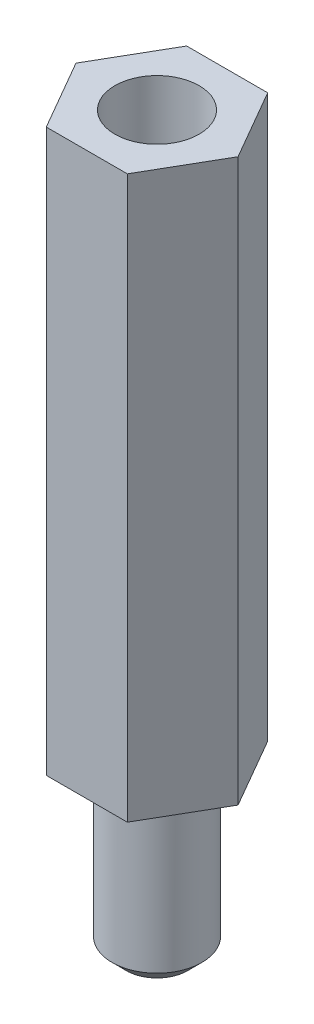
from build123d import *

# Parameters (mm, degrees)
SKETCH1_R           = 1.5
EXTRUDE1_DEPTH      = 20
EXTRUDE2_DEPTH      = 6
EXTRUDE2_DEPTH_BACK = 12
SKETCH2_R           = 1.6
CHAMFER1_SIZE       = 0.5
FILLET1_R           = 0.5
FILLET2_R           = 1


with BuildPart() as part:
    # Sketch1 → Extrude1 (new body)
    with BuildSketch(Plane(origin=(0, 0, 0), x_dir=(1, 0, 0), z_dir=(0, 1, 0))):
        Polygon((-1.443375673, 2.5), (1.443375673, 2.5), (2.886751346, 0), (1.443375673, -2.5), (-1.443375673, -2.5), (-2.886751346, 0), align=None)
        with Locations(Location((0, 0, 0), (0, 0, 270))):
            Circle(SKETCH1_R, mode=Mode.SUBTRACT)
    extrude(amount=EXTRUDE1_DEPTH)

    # Sketch2 → Extrude2 (add, two sides: drawn at the far end of the back side and taken through both)
    with BuildSketch(Plane.XZ.offset(-EXTRUDE2_DEPTH_BACK)):
        with Locations(Location((0, 0, 0), (0, 0, 270))):
            Circle(SKETCH2_R)
    extrude(amount=EXTRUDE2_DEPTH + EXTRUDE2_DEPTH_BACK)

    # Chamfer1
    chamfer1_edges = [part.edges().sort_by_distance(p)[0] for p in [
        (0, -6, 1.6),
    ]]
    chamfer(chamfer1_edges, length=CHAMFER1_SIZE)

    # Fillet1
    fillet1_edges = [part.edges().sort_by_distance(p)[0] for p in [
        (0, 0, 1.6),
    ]]
    fillet(fillet1_edges, radius=FILLET1_R)

    # Fillet2
    fillet2_edges = [part.edges().sort_by_distance(p)[0] for p in [
        (0, 12, -1.5),
    ]]
    fillet(fillet2_edges, radius=FILLET2_R)


solid = part.part
